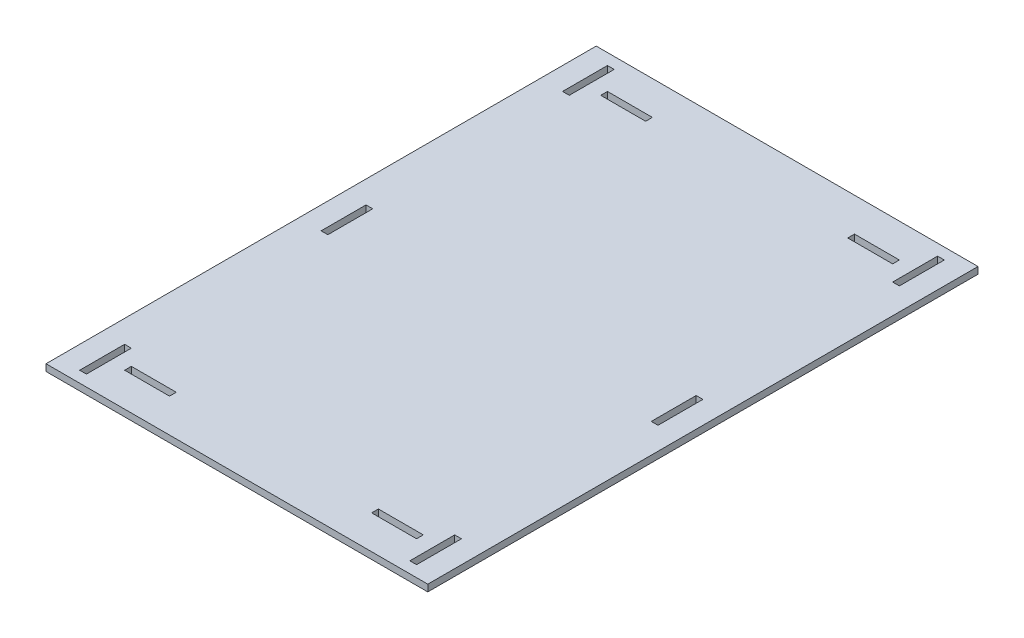
from build123d import *

# Parameters (mm, degrees)
SKETCH1_W            = 340
SKETCH1_H            = 490
BOSS_EXTRUDE1_DEPTH  = 6
SKETCH2_W            = 6
SKETCH2_H            = 40
CUT_EXTRUDE1_DEPTH   = 6
LPATTERN1_COUNT      = 2
LPATTERN1_PITCH      = 294
LPATTERN1_COUNT_DIR2 = 3
LPATTERN1_PITCH_DIR2 = 215
SKETCH3_W            = 40
SKETCH3_H            = 6
CUT_EXTRUDE2_DEPTH   = 10
LPATTERN2_COUNT      = 2
LPATTERN2_PITCH      = 220
LPATTERN2_COUNT_DIR2 = 2
LPATTERN2_PITCH_DIR2 = 424


with BuildPart() as part:
    # Sketch1 → Boss-Extrude1 (new body)
    with BuildSketch(Plane(origin=(0, 0, 0), x_dir=(1, 0, 0), z_dir=(0, 1, 0))):
        with Locations((170, 245)):
            Rectangle(SKETCH1_W, SKETCH1_H)
    extrude(amount=BOSS_EXTRUDE1_DEPTH)

    # Sketch2 → Cut-Extrude1 (cut)
    with BuildSketch(Plane(origin=(0, 6, 0), x_dir=(1, 0, 0), z_dir=(0, 1, 0))):
        with Locations((23, 460)):
            Rectangle(SKETCH2_W, SKETCH2_H)
    cut_extrude1 = extrude(amount=-CUT_EXTRUDE1_DEPTH, mode=Mode.SUBTRACT)

    # LPattern1: Cut-Extrude1 2 × 3
    with Locations(*[(i * LPATTERN1_PITCH, 0, j * LPATTERN1_PITCH_DIR2) for i in range(LPATTERN1_COUNT) for j in range(LPATTERN1_COUNT_DIR2) if (i, j) != (0, 0)]):
        add(cut_extrude1, mode=Mode.SUBTRACT)

    # Sketch3 → Cut-Extrude2 (cut)
    with BuildSketch(Plane(origin=(0, 6, 0), x_dir=(1, 0, 0), z_dir=(0, 1, 0))):
        with Locations((280, 457)):
            Rectangle(SKETCH3_W, SKETCH3_H)
    cut_extrude2 = extrude(amount=-CUT_EXTRUDE2_DEPTH, mode=Mode.SUBTRACT)

    # LPattern2: Cut-Extrude2 2 × 2
    with Locations(*[(-i * LPATTERN2_PITCH, 0, j * LPATTERN2_PITCH_DIR2) for i in range(LPATTERN2_COUNT) for j in range(LPATTERN2_COUNT_DIR2) if (i, j) != (0, 0)]):
        add(cut_extrude2, mode=Mode.SUBTRACT)


solid = part.part
